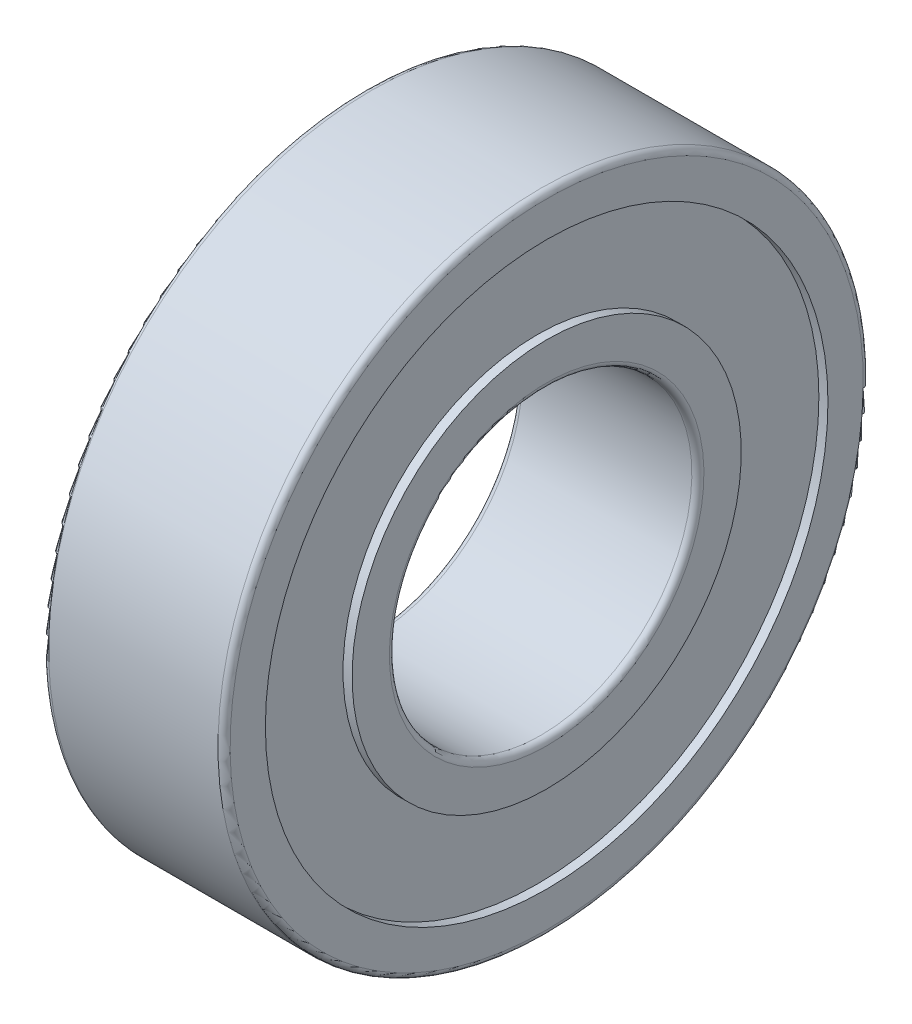
from build123d import *

# Parameters (mm, degrees)
FILLET1_R = 0.3


with BuildPart() as part:
    # Sketch1 → Revolve1 (revolve)
    with BuildSketch(Plane.XY, mode=Mode.PRIVATE) as revolve1_sk:
        Polygon((0, 7.5), (0, 9.65), (0.45, 9.65), (0.45, 13.95), (0, 13.95), (0, 16), (9, 16), (9, 13.95), (8.55, 13.95), (8.55, 9.65), (9, 9.65), (9, 7.5), align=None)
    revolve(revolve1_sk.sketch.rotate(Axis((0, 0, 0), (1, 0, 0)), 180), axis=Axis((0, 0, 0), (1, 0, 0)))

    # Fillet1
    fillet1_edges = [part.edges().sort_by_distance(p)[0] for p in [
        (9, 16, 0),
        (0, 16, 0),
        (0, 7.5, 0),
        (9, 7.5, 0),
    ]]
    fillet(fillet1_edges, radius=FILLET1_R)


solid = part.part
